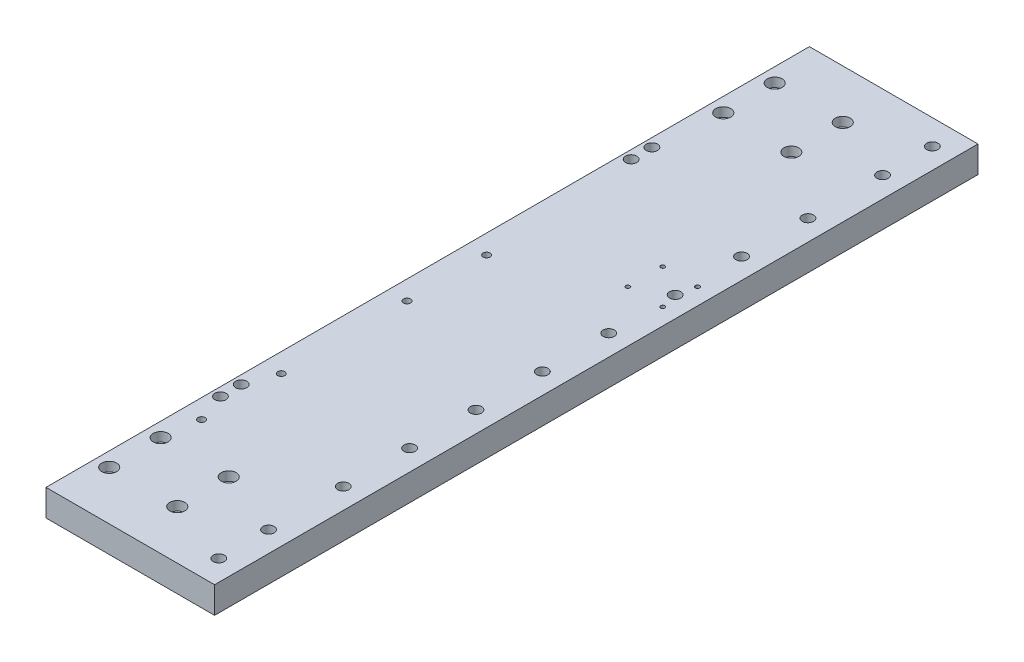
from build123d import *

# Parameters (mm, degrees)
SKETCH1_W                                            = 203.2
SKETCH1_H                                            = 920
BOSS_EXTRUDE1_DEPTH                                  = 50.8
SKETCH2_W                                            = 203.2
SKETCH2_H                                            = 5
CUT_EXTRUDE1_DEPTH                                   = 944.541668396
SKETCH6_W                                            = 256
SKETCH6_H                                            = 13.8
CUT_EXTRUDE3_DEPTH                                   = 944.541668396
M12_CLEARANCE_HOLE1_D                                = 13.5
CBORE_FOR_M10_HEX_SOCKET_HEAD_CAP_SCREW1_D           = 11
CBORE_FOR_M10_HEX_SOCKET_HEAD_CAP_SCREW1_CBORE_D     = 18
CBORE_FOR_M10_HEX_SOCKET_HEAD_CAP_SCREW1_CBORE_DEPTH = 11
M6_TAPPED_HOLE1_D                                    = 5
M6_TAPPED_HOLE1_DEPTH                                = 27.99
M6_TAPPED_HOLE1_TIP                                  = 1.502151548
M6_TAPPED_HOLE2_D                                    = 5
M6_TAPPED_HOLE2_DEPTH                                = 27.99
M6_TAPPED_HOLE2_TIP                                  = 1.502151548
F_13_5_13_5_DIAMETER_HOLE1_D                         = 13.5
F_13_5_13_5_DIAMETER_HOLE1_DEPTH                     = 20
F_13_5_13_5_DIAMETER_HOLE1_TIP                       = 4.055809178
M10_TAPPED_HOLE1_D                                   = 8.5
M10_TAPPED_HOLE1_DEPTH                               = 38
M10_TAPPED_HOLE1_TIP                                 = 2.553657631


with BuildPart() as part:
    # Sketch1 → Boss-Extrude1 (new body)
    with BuildSketch(Plane(origin=(0, 0, 0), x_dir=(1, 0, 0), z_dir=(0, 1, 0))):
        with Locations((101.6, 460)):
            Rectangle(SKETCH1_W, SKETCH1_H)
    extrude(amount=BOSS_EXTRUDE1_DEPTH)

    # Sketch2 → Cut-Extrude1 (cut, through all)
    with BuildSketch(Plane(origin=(0, 0, -920), x_dir=(-1, 0, 0), z_dir=(0, 0, -1))):
        with Locations((-101.6, 2.5)):
            Rectangle(SKETCH2_W, SKETCH2_H)
    extrude(amount=-CUT_EXTRUDE1_DEPTH, mode=Mode.SUBTRACT)

    # Sketch6 → Cut-Extrude3 (cut, through all)
    with BuildSketch(Plane(origin=(0, 0, -920), x_dir=(-1, 0, 0), z_dir=(0, 0, -1))):
        with Locations((-75.2, 43.9)):
            Rectangle(SKETCH6_W, SKETCH6_H)
    extrude(amount=-CUT_EXTRUDE3_DEPTH, mode=Mode.SUBTRACT)

    # M12 Clearance Hole1 (through all)
    with Locations(Plane(origin=(7.928034887, 37, -192.870856327), x_dir=(-1, 0, 0), z_dir=(0, 1, 0))):
        with Locations((-170.271965113, 162.870856327), (-170.271965113, -697.129143673), (-170.271965113, -637.129143673), (-170.271965113, -547.129143673), (-170.271965113, -467.129143673), (-170.271965113, -307.129143673), (-170.271965113, -147.129143673), (-170.271965113, -67.129143673), (-170.271965113, 102.870856327), (-170.271965113, -387.129143673), (-170.271965113, -227.129143673), (-170.271965113, 12.870856327)):
            Hole(M12_CLEARANCE_HOLE1_D / 2)

    # CBORE for M10 Hex Socket Head Cap Screw1 (through all)
    with Locations(Plane(origin=(-145.411860995, 37, -401.636592577), x_dir=(1, 0, 0), z_dir=(0, 1, 0))):
        with Locations((162.611860995, -280.636592577), (244.611860995, -342.636592577), (162.611860995, -342.636592577), (244.611860995, -280.636592577), (162.611860995, 459.363407423), (244.611860995, 397.363407423), (162.611860995, 397.363407423), (244.611860995, 459.363407423)):
            CounterBoreHole(CBORE_FOR_M10_HEX_SOCKET_HEAD_CAP_SCREW1_D / 2, CBORE_FOR_M10_HEX_SOCKET_HEAD_CAP_SCREW1_CBORE_D / 2, CBORE_FOR_M10_HEX_SOCKET_HEAD_CAP_SCREW1_CBORE_DEPTH)

    # M6 Tapped Hole1
    with Locations(Plane.XZ.offset(-5)):
        with Locations((10.2, -720), (10.2, -695), (10.2, -200), (10.2, -225)):
            Hole(M6_TAPPED_HOLE1_D / 2, depth=M6_TAPPED_HOLE1_DEPTH)
            with Locations((0, 0, -(M6_TAPPED_HOLE1_DEPTH + M6_TAPPED_HOLE1_TIP / 2))):  # 118° drill point
                Cone(0, M6_TAPPED_HOLE1_D / 2, M6_TAPPED_HOLE1_TIP, mode=Mode.SUBTRACT)

    # M6 Tapped Hole2
    with Locations(Plane(origin=(0, 37, 0), x_dir=(1, 0, 0), z_dir=(0, 1, 0))):
        with Locations((141.2, 560), (183.2, 602), (141.2, 602), (183.2, 560)):
            Hole(M6_TAPPED_HOLE2_D / 2, depth=M6_TAPPED_HOLE2_DEPTH)
            with Locations((0, 0, -(M6_TAPPED_HOLE2_DEPTH + M6_TAPPED_HOLE2_TIP / 2))):  # 118° drill point
                Cone(0, M6_TAPPED_HOLE2_D / 2, M6_TAPPED_HOLE2_TIP, mode=Mode.SUBTRACT)

    # Ø13.5 (13.5) Diameter Hole1
    with Locations(Plane(origin=(0, 37, 0), x_dir=(1, 0, 0), z_dir=(0, 1, 0))):
        with Locations((10.2, 720), (10.2, 695), (10.2, 225), (10.2, 200)):
            Hole(F_13_5_13_5_DIAMETER_HOLE1_D / 2, depth=F_13_5_13_5_DIAMETER_HOLE1_DEPTH)
            with Locations((0, 0, -(F_13_5_13_5_DIAMETER_HOLE1_DEPTH + F_13_5_13_5_DIAMETER_HOLE1_TIP / 2))):  # 118° drill point
                Cone(0, F_13_5_13_5_DIAMETER_HOLE1_D / 2, F_13_5_13_5_DIAMETER_HOLE1_TIP, mode=Mode.SUBTRACT)

    # M10 Tapped Hole1
    with Locations(Plane(origin=(0, 37, 0), x_dir=(1, 0, 0), z_dir=(0, 1, 0))):
        with Locations((23, 164.5), (23, 260.5), (23, 508), (23, 412)):
            Hole(M10_TAPPED_HOLE1_D / 2, depth=M10_TAPPED_HOLE1_DEPTH)
            with Locations((0, 0, -(M10_TAPPED_HOLE1_DEPTH + M10_TAPPED_HOLE1_TIP / 2))):  # 118° drill point
                Cone(0, M10_TAPPED_HOLE1_D / 2, M10_TAPPED_HOLE1_TIP, mode=Mode.SUBTRACT)


solid = part.part
